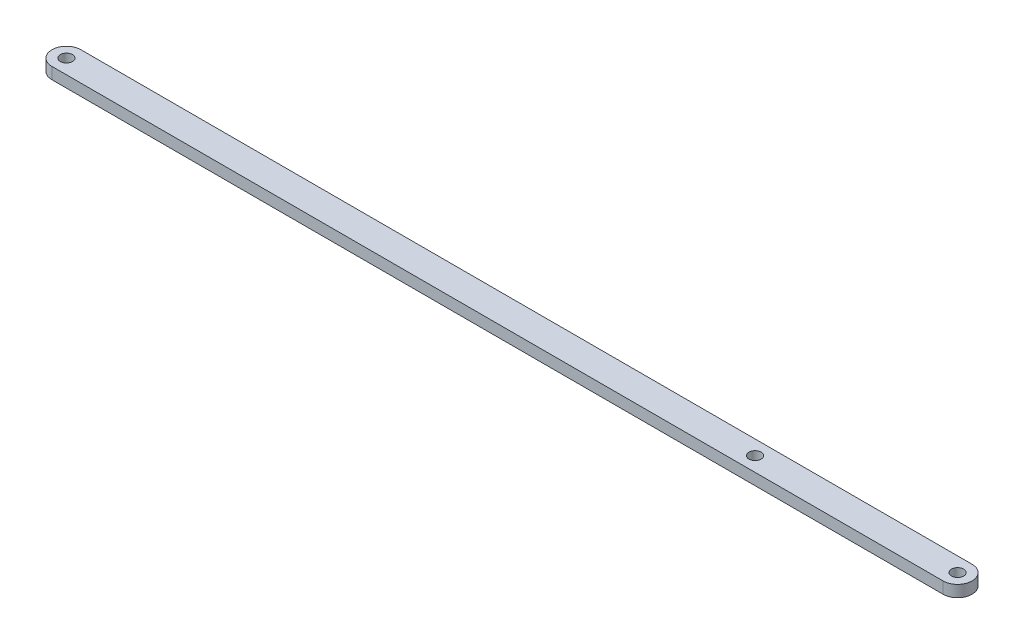
from build123d import *

# Parameters (mm, degrees)
SKETCH1_R           = 1.05
BOSS_EXTRUDE1_DEPTH = 2


with BuildPart() as part:
    # Sketch1 → Boss-Extrude1 (new body)
    with BuildSketch(Plane(origin=(0, 0, 0), x_dir=(1, 0, 0), z_dir=(0, 1, 0))):
        with BuildLine():
            Line((0, 2.5), (154, 2.5))
            ThreePointArc((154, 2.5), (156.5, 0), (154, -2.5))
            Line((154, -2.5), (0, -2.5))
            ThreePointArc((0, -2.5), (-2.5, 0), (0, 2.5))
        make_face()
        with Locations(Location((0, 0, 0), (0, 0, 270))):
            Circle(SKETCH1_R, mode=Mode.SUBTRACT)
        with Locations(Location((154, 0, 0), (0, 0, 270))):
            Circle(SKETCH1_R, mode=Mode.SUBTRACT)
        with Locations(Location((119, 0, 0), (0, 0, 270))):
            Circle(SKETCH1_R, mode=Mode.SUBTRACT)
    extrude(amount=BOSS_EXTRUDE1_DEPTH)


solid = part.part
